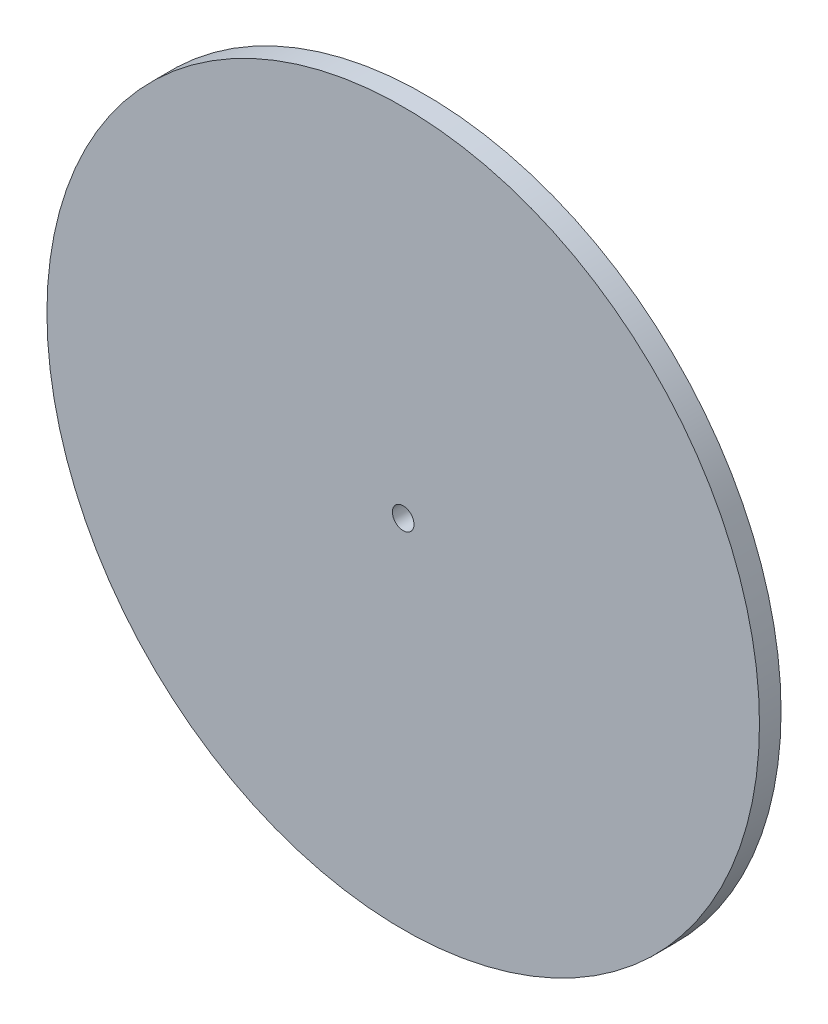
from build123d import *

# Parameters (mm, degrees)
SKETCH1_R           = 165
SKETCH1_R_2         = 5
BOSS_EXTRUDE1_DEPTH = 10


with BuildPart() as part:
    # Sketch1 → Boss-Extrude1 (new body)
    with BuildSketch(Plane.XY):
        Circle(SKETCH1_R)
        Circle(SKETCH1_R_2, mode=Mode.SUBTRACT)
    extrude(amount=BOSS_EXTRUDE1_DEPTH)


solid = part.part
